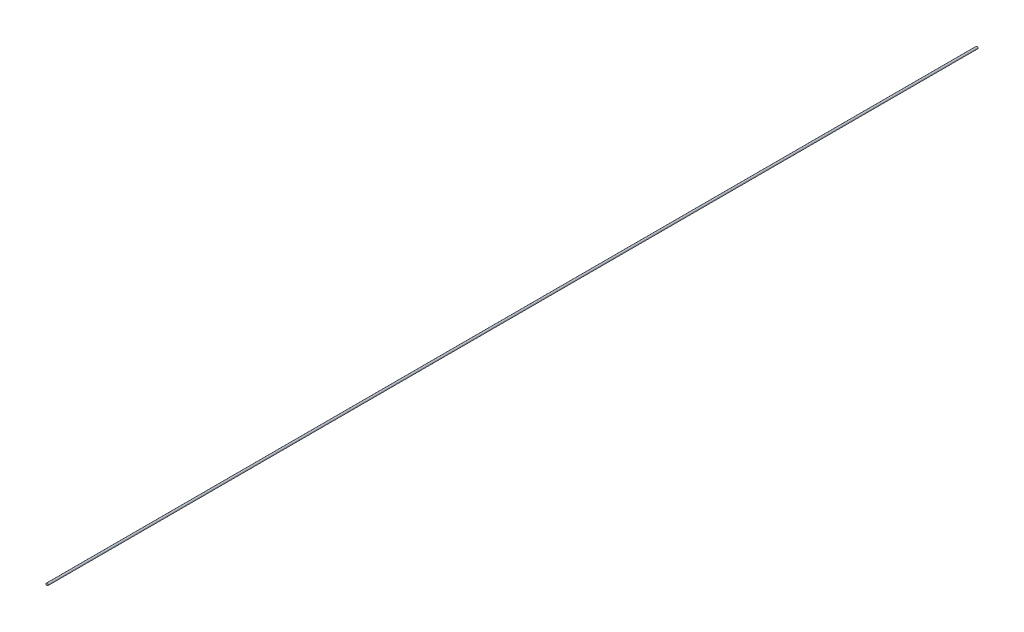
from build123d import *

# Parameters (mm, degrees)
SKETCH1_R           = 0.15
BOSS_EXTRUDE1_DEPTH = 133


with BuildPart() as part:
    # Sketch1 → Boss-Extrude1 (new body)
    with BuildSketch(Plane.XY):
        Circle(SKETCH1_R)
    extrude(amount=BOSS_EXTRUDE1_DEPTH)


solid = part.part
